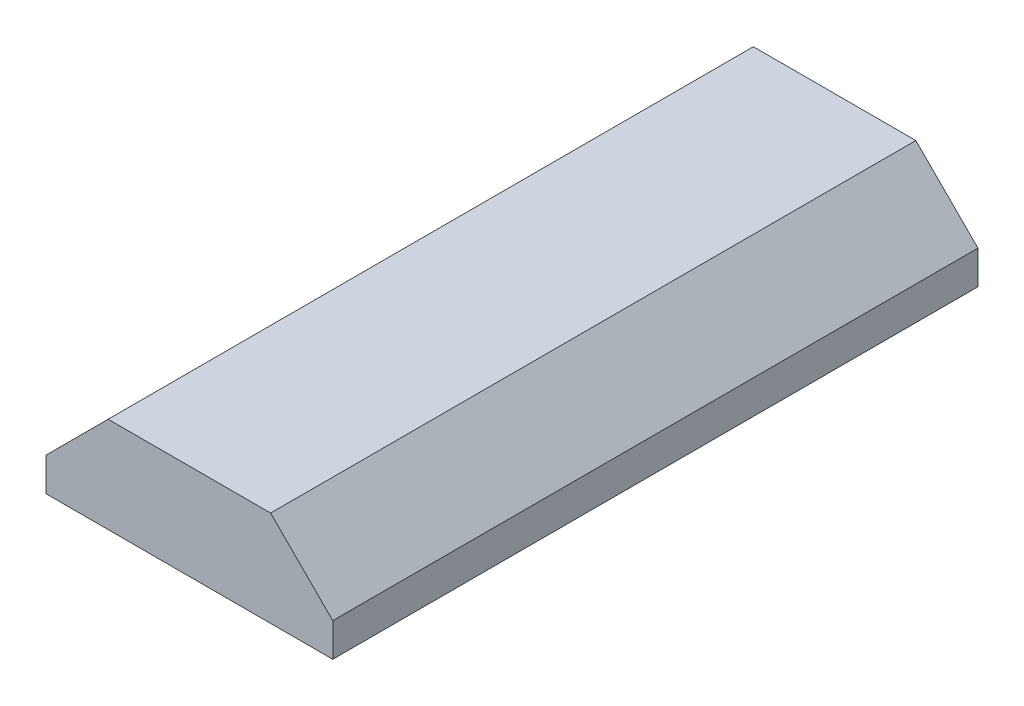
from build123d import *

# Parameters (mm, degrees)
AUFSATZ_LINEAR_AUSTRAGEN1_DEPTH = 27


with BuildPart() as part:
    # Skizze1 → Aufsatz-Linear austragen1 (new body)
    with BuildSketch(Plane.XY):
        Polygon((3.4, 1.808858787), (-3.4, 1.808858787), (-6, -0.791141213), (-6, -2.191141213), (6, -2.191141213), (6, -0.791141213), align=None)
    extrude(amount=AUFSATZ_LINEAR_AUSTRAGEN1_DEPTH)


solid = part.part
